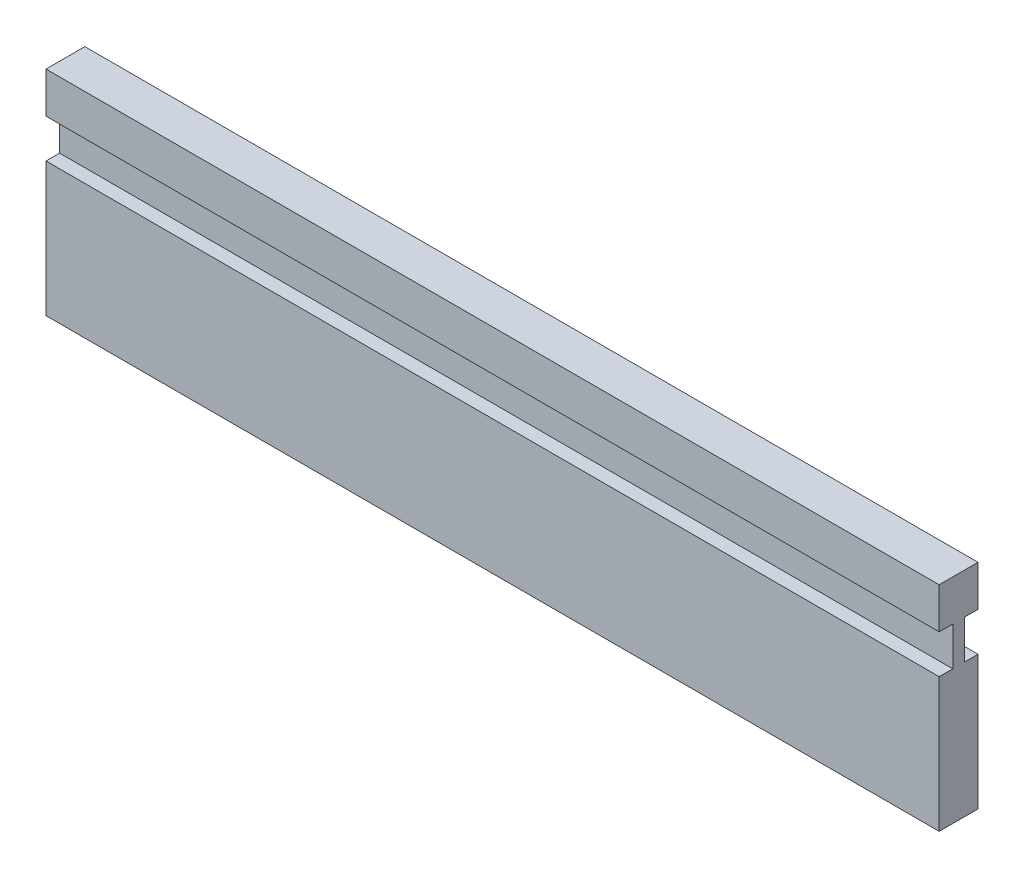
from build123d import *

# Parameters (mm, degrees)
CROQUIS1_W              = 460
CROQUIS1_H              = 110
SALIENTE_EXTRUIR1_DEPTH = 20
CROQUIS8_W              = 480
CROQUIS8_H              = 20
CORTAR_EXTRUIR3_DEPTH   = 7
CROQUIS9_W              = 470
CROQUIS9_H              = 20
CORTAR_EXTRUIR4_DEPTH   = 7


with BuildPart() as part:
    # Croquis1 → Saliente-Extruir1 (new body)
    with BuildSketch(Plane.XY):
        Rectangle(CROQUIS1_W, CROQUIS1_H)
    extrude(amount=SALIENTE_EXTRUIR1_DEPTH)

    # Croquis8 → Cortar-Extruir3 (cut)
    with BuildSketch(Plane.XY.offset(20)):
        with Locations((-10, 24)):
            Rectangle(CROQUIS8_W, CROQUIS8_H)
    extrude(amount=-CORTAR_EXTRUIR3_DEPTH, mode=Mode.SUBTRACT)

    # Croquis9 → Cortar-Extruir4 (cut)
    with BuildSketch(Plane(origin=(0, 0, 0), x_dir=(-1, 0, 0), z_dir=(0, 0, -1))):
        with Locations((-5, 24)):
            Rectangle(CROQUIS9_W, CROQUIS9_H)
    extrude(amount=-CORTAR_EXTRUIR4_DEPTH, mode=Mode.SUBTRACT)


solid = part.part
